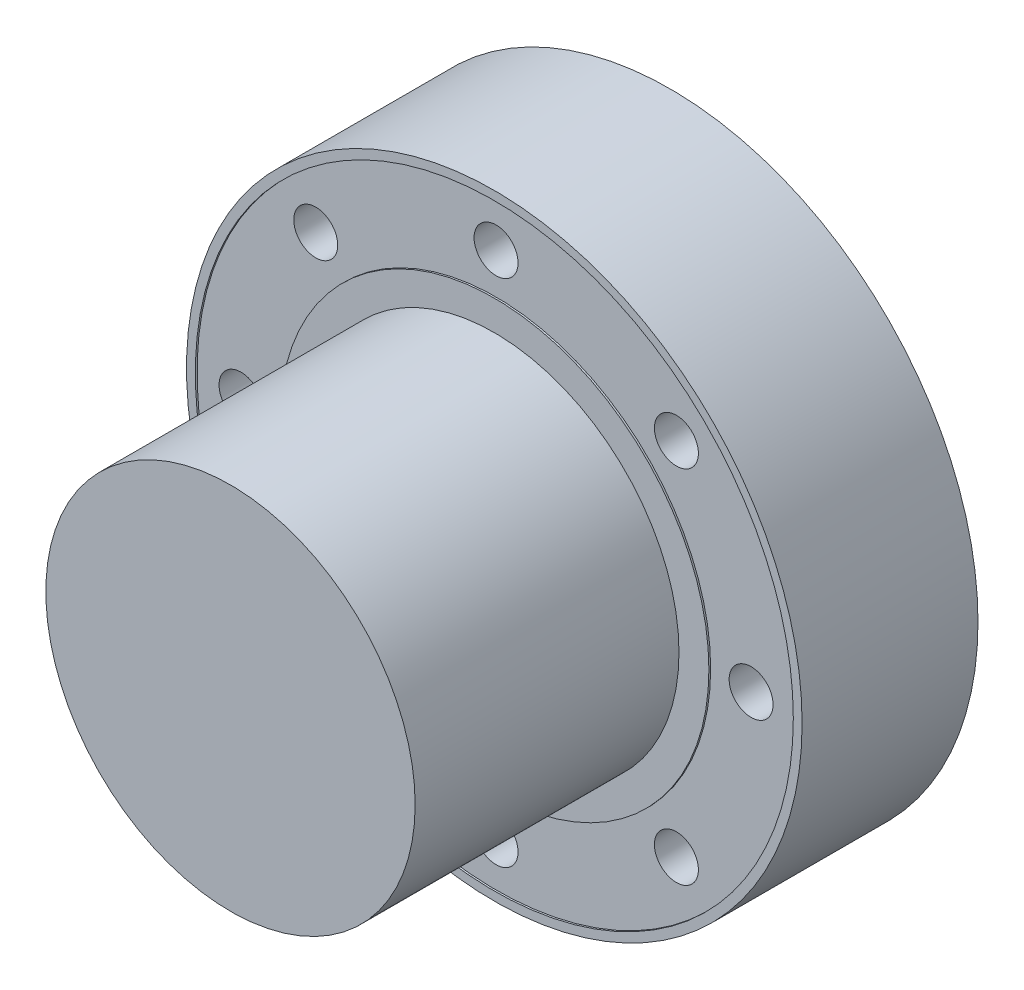
from build123d import *

# Parameters (mm, degrees)
SKETCH_1_R               = 350
EXTRUDE_1_DEPTH          = 200
SKETCH_2_R               = 210
EXTRUDE_2_DEPTH          = 300
SKETCH_3_R               = 340
SKETCH_3_R_2             = 244
CUT_EXTRUDE_1_DEPTH      = 2
SKETCH_4_R               = 25
CUT_EXTRUDE_2_DEPTH      = 704.562363974
PATTERN_CIRCULAR_1_COUNT = 8


with BuildPart() as part:
    # 草图1 → 凸台-拉伸1 (new body)
    with BuildSketch(Plane.XY):
        Circle(SKETCH_1_R)
    extrude(amount=EXTRUDE_1_DEPTH)

    # 草图2 → 凸台-拉伸2 (add)
    with BuildSketch(Plane.XY.offset(200)):
        Circle(SKETCH_2_R)
    extrude(amount=EXTRUDE_2_DEPTH)

    # 草图3 → 切除-拉伸1 (cut)
    with BuildSketch(Plane.XY.offset(200)):
        Circle(SKETCH_3_R)
        Circle(SKETCH_3_R_2, mode=Mode.SUBTRACT)
    extrude(amount=-CUT_EXTRUDE_1_DEPTH, mode=Mode.SUBTRACT)

    # 草图4 → 切除-拉伸2 (cut, through all)
    with BuildSketch(Plane(origin=(0, 0, 0), x_dir=(-1, 0, 0), z_dir=(0, 0, -1))):
        with Locations((0, 290)):
            Circle(SKETCH_4_R)
    cut_extrude_2 = extrude(amount=-CUT_EXTRUDE_2_DEPTH, mode=Mode.SUBTRACT)

    # 阵列(圆周)1: 切除-拉伸2 ×8 about axis
    pattern_circular_1_axis = Axis((0, 0, 0), (0, 0, 1))
    for i in range(1, PATTERN_CIRCULAR_1_COUNT):
        add(cut_extrude_2.rotate(pattern_circular_1_axis, i * 360 / PATTERN_CIRCULAR_1_COUNT), mode=Mode.SUBTRACT)


solid = part.part
